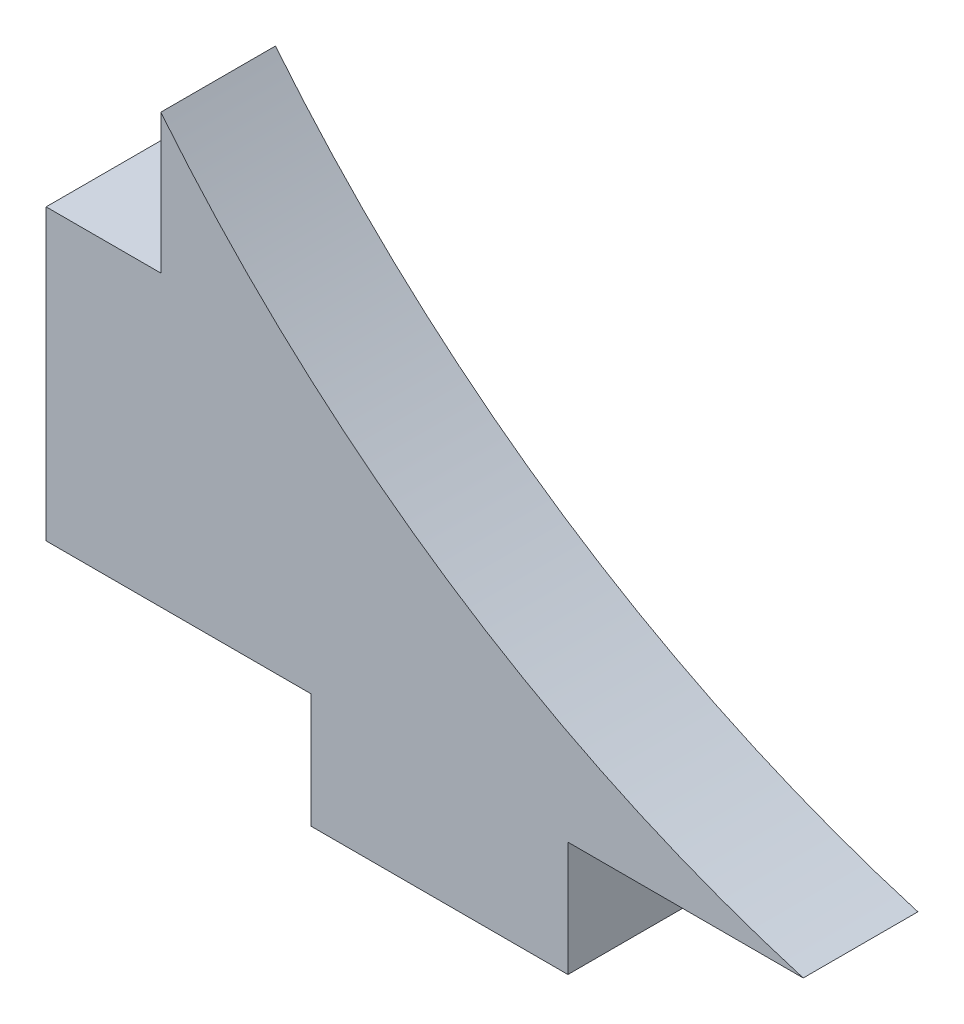
from build123d import *

# Parameters (mm, degrees)
BOSS_EXTRUDE1_DEPTH = 5.35


with BuildPart() as part:
    # Model → Boss-Extrude1 (new body)
    with BuildSketch(Plane.XY):
        with BuildLine():
            ThreePointArc((-13, 25.35), (0.467134815, 13.067225088), (16.98, 5.35))
            Line((16.98, 5.35), (6, 5.35))
            Line((6, 5.35), (6, 0))
            Line((6, 0), (-6, 0))
            Line((-6, 0), (-6, 5.35))
            Line((-6, 5.35), (-18.35, 5.35))
            Line((-18.35, 5.35), (-18.35, 18.85))
            Line((-18.35, 18.85), (-13, 18.85))
            Line((-13, 18.85), (-13, 25.35))
        make_face()
    extrude(amount=BOSS_EXTRUDE1_DEPTH)


solid = part.part
